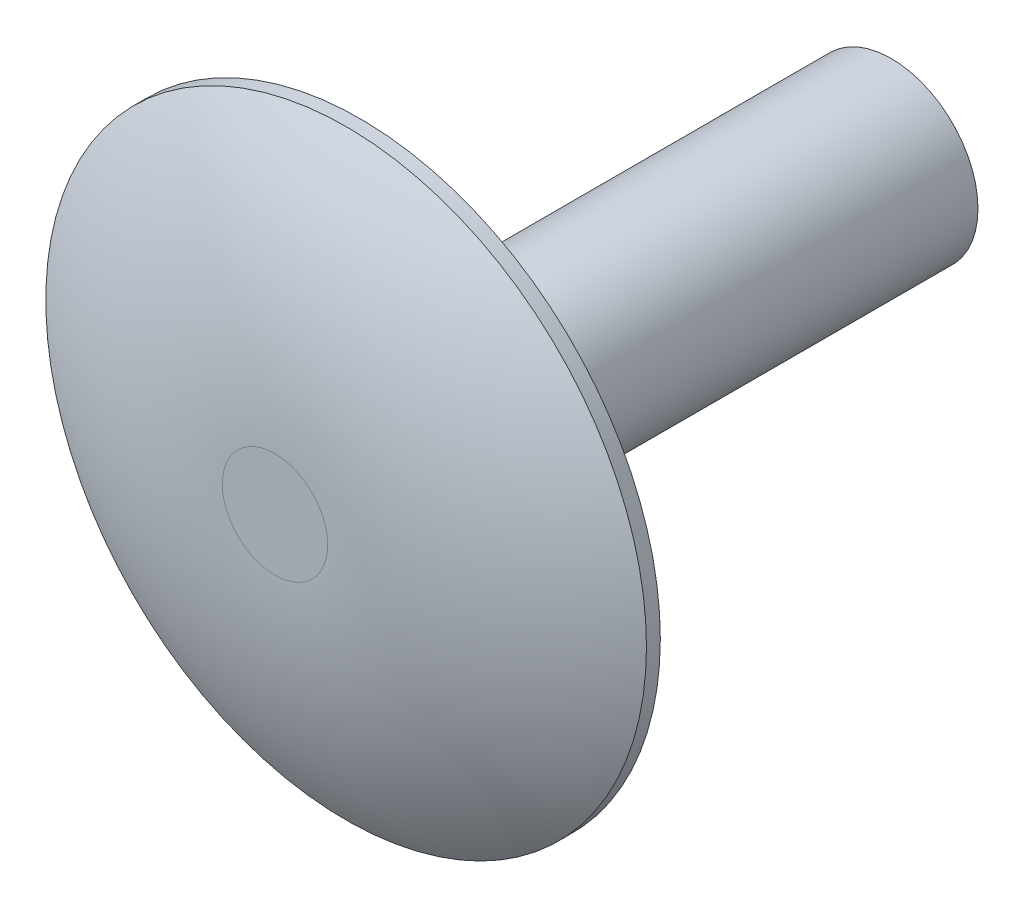
from build123d import *

# Parameters (mm, degrees)
SKETCH1_R           = 8.255
BOSS_EXTRUDE1_DEPTH = 2.3368
SKETCH2_R           = 2.38125
BOSS_EXTRUDE2_DEPTH = 14.605


with BuildPart() as part:
    # Sketch1 → Boss-Extrude1 (new body)
    with BuildSketch(Plane.XY):
        Circle(SKETCH1_R)
    extrude(amount=BOSS_EXTRUDE1_DEPTH)

    # Sketch2 → Boss-Extrude2 (add)
    with BuildSketch(Plane.XY):
        Circle(SKETCH2_R)
    extrude(amount=-BOSS_EXTRUDE2_DEPTH)

    # Sketch3 → Cut-Revolve1 (revolve, cut)
    with BuildSketch(Plane(origin=(0, 0, 0), x_dir=(1, 0, 0), z_dir=(0, 1, 0))):
        with BuildLine():
            ThreePointArc((1.4478, -2.3368), (4.989096566, -1.838155581), (8.255, -0.381))
            Line((8.255, -0.381), (8.255, -2.3368))
            Line((8.255, -2.3368), (1.4478, -2.3368))
        make_face()
    revolve(axis=Axis((0, 0, 2.3368), (0, 0, -1)), mode=Mode.SUBTRACT)


solid = part.part
